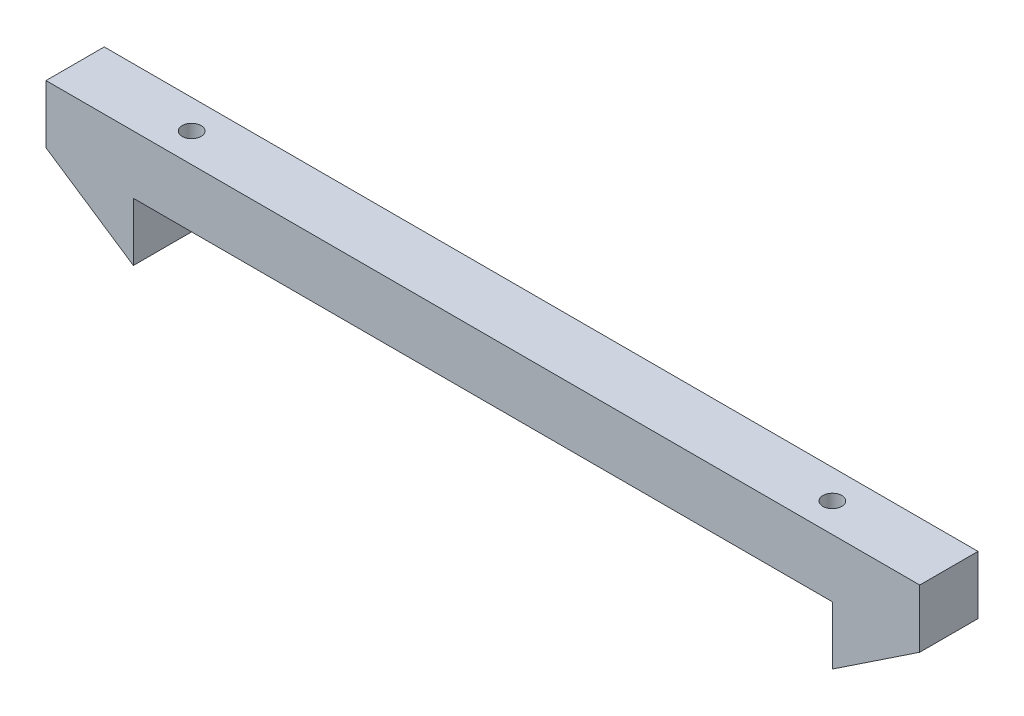
from build123d import *

# Parameters (mm, degrees)
BOSS_EXTRUDE1_DEPTH = 8
CUT_EXTRUDE1_REACH  = 63.057
SKETCH2_R           = 1.3


with BuildPart() as part:
    # Sketch1 → Boss-Extrude1 (new body)
    with BuildSketch(Plane(origin=(0, 0, 0), x_dir=(0, 1, 0), z_dir=(0, 0, 1))):
        Polygon((0, 48), (0, -48), (-8, -48), (0, -60), (8, -60), (8, 60), (0, 60), (-8, 48), align=None)
    extrude(amount=BOSS_EXTRUDE1_DEPTH)

    # Sketch2 → Cut-Extrude1 (cut, up to next)
    with BuildSketch(Plane.XZ, mode=Mode.PRIVATE) as cut_extrude1_sk1:
        with Locations((-44, 4)):
            Circle(SKETCH2_R)
    cut_extrude1_tool1 = extrude(cut_extrude1_sk1.sketch, amount=-CUT_EXTRUDE1_REACH, mode=Mode.PRIVATE) & part.part
    # Sketch2 → Cut-Extrude1 (cut, up to next)
    with BuildSketch(Plane.XZ, mode=Mode.PRIVATE) as cut_extrude1_sk2:
        with Locations(Location((44, 4, 0), (0, 0, 270))):
            Circle(SKETCH2_R)
    cut_extrude1_tool2 = extrude(cut_extrude1_sk2.sketch, amount=-CUT_EXTRUDE1_REACH, mode=Mode.PRIVATE) & part.part
    add(cut_extrude1_tool1.solids().sort_by_distance((-44, 0, 4))[0], mode=Mode.SUBTRACT)
    add(cut_extrude1_tool2.solids().sort_by_distance((44, 0, 4))[0], mode=Mode.SUBTRACT)


solid = part.part
